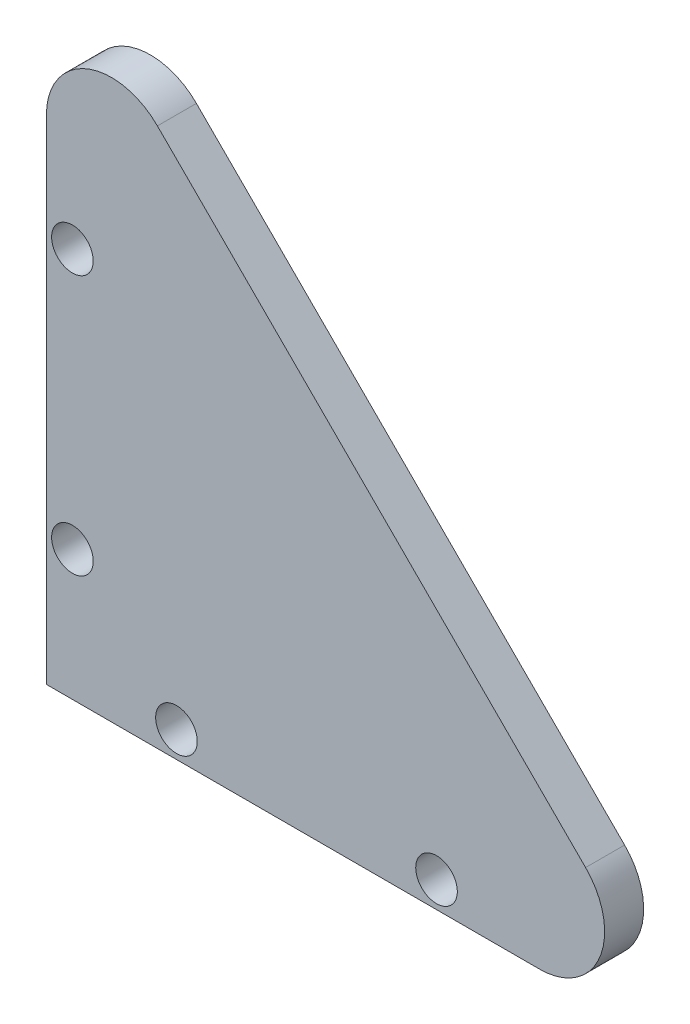
from build123d import *

# Parameters (mm, degrees)
BOSS_EXTRUDE1_DEPTH = 3
SKETCH2_R           = 1.6
CUT_EXTRUDE1_DEPTH  = 3
FILLET2_R           = 5


with BuildPart() as part:
    # Sketch1 → Boss-Extrude1 (new body)
    with BuildSketch(Plane.XY):
        Polygon((-27.9172032, 22.65625), (-27.9172032, -27.34375), (22.0827968, -27.34375), align=None)
    extrude(amount=BOSS_EXTRUDE1_DEPTH)

    # Sketch2 → Cut-Extrude1 (cut)
    with BuildSketch(Plane.XY.offset(3)):
        with Locations((-25.9172032, -17.34375)):
            Circle(SKETCH2_R)
        with Locations((-25.9172032, 2.65625)):
            Circle(SKETCH2_R)
        with Locations(Location((-17.9172032, -25.34375, 0), (0, 0, 180))):
            Circle(SKETCH2_R)
        with Locations(Location((2.0827968, -25.34375, 0), (0, 0, 180))):
            Circle(SKETCH2_R)
    extrude(amount=-CUT_EXTRUDE1_DEPTH, mode=Mode.SUBTRACT)

    # Fillet2
    fillet2_edges = [part.edges().sort_by_distance(p)[0] for p in [
        (22.0827968, -27.34375, 1.5),
        (-27.9172032, 22.65625, 1.5),
    ]]
    fillet(fillet2_edges, radius=FILLET2_R)


solid = part.part
